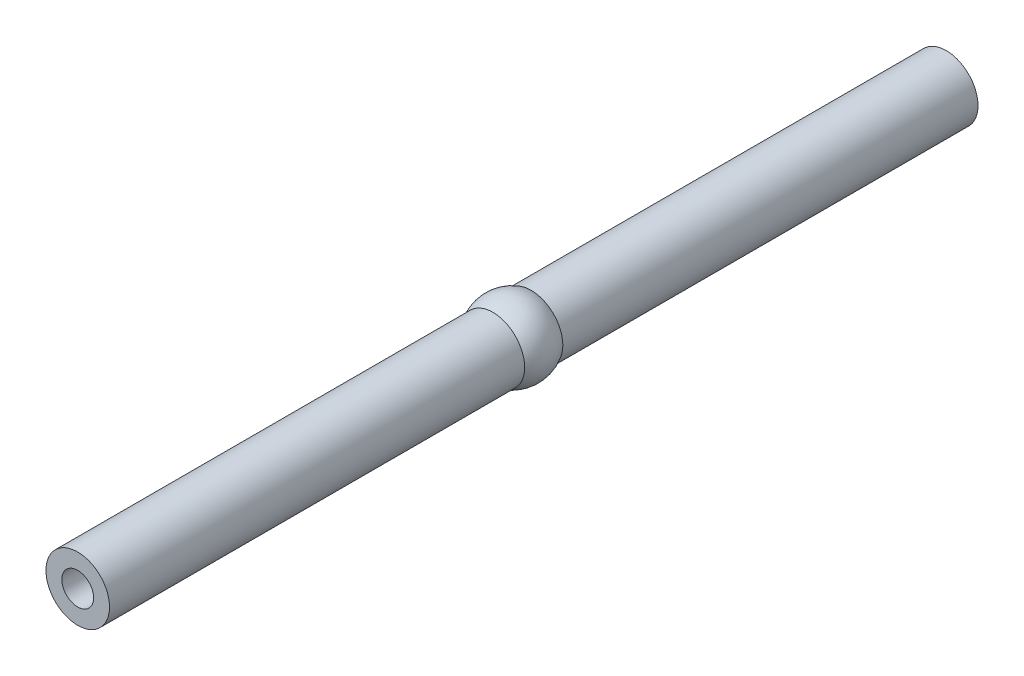
from build123d import *

# Parameters (mm, degrees)
ESQUISSE1_R             = 3
EXTRUSION1_DEPTH        = 41
ESQUISSE2_R             = 1.5
ENL_V_MAT_EXTRU_1_DEPTH = 10


with BuildPart() as part:
    # Esquisse1 → Extrusion1 (new, symmetric)
    with BuildSketch(Plane.XY):
        Circle(ESQUISSE1_R)
    extrude(amount=EXTRUSION1_DEPTH, both=True)

    # Esquisse2 → Enlèv. mat.-Extru.1 (cut)
    with BuildSketch(Plane.XY.offset(41)):
        Circle(ESQUISSE2_R)
    enl_v_mat_extru_1 = extrude(amount=-ENL_V_MAT_EXTRU_1_DEPTH, mode=Mode.SUBTRACT)

    # Symétrie1: Enlèv. mat.-Extru.1 across plane
    add(enl_v_mat_extru_1.mirror(Plane.XY), mode=Mode.SUBTRACT)

    # Esquisse3 → Révolution1 (revolve)
    with BuildSketch(Plane(origin=(0, 0, 0), x_dir=(1, 0, 0), z_dir=(0, 1, 0))):
        with BuildLine():
            Line((0, -3.5), (0, 3.5))
            ThreePointArc((0, 3.5), (-3.5, 0), (0, -3.5))
        make_face()
    revolve(axis=Axis((0, 0, -20.452007924), (0, 0, 1)))


solid = part.part
